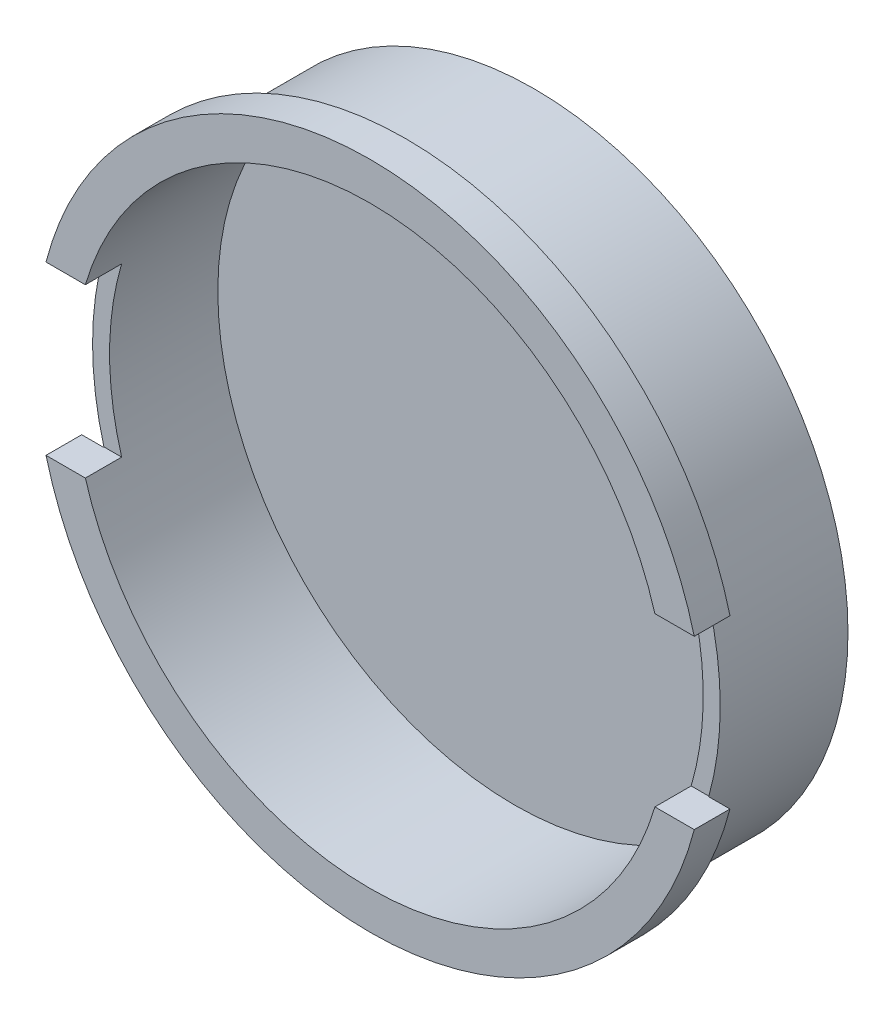
from build123d import *

# Parameters (mm, degrees)
SKETCH1_R           = 14.2875
BOSS_EXTRUDE1_DEPTH = 0.889
SKETCH2_R           = 14.2875
SKETCH2_R_2         = 13.5128
BOSS_EXTRUDE2_DEPTH = 4.953
SKETCH3_R           = 15.24
SKETCH3_R_2         = 13.5128
BOSS_EXTRUDE3_DEPTH = 1.6256
SKETCH4_W           = 38.1
SKETCH4_H           = 7.62
CUT_EXTRUDE1_DEPTH  = 1.651
SKETCH5_R           = 0.381
CUT_EXTRUDE2_DEPTH  = 23.480911787
SKETCH7_R           = 0.381
BOSS_EXTRUDE5_DEPTH = 0.9144


with BuildPart() as part:
    # Sketch1 → Boss-Extrude1 (new body)
    with BuildSketch(Plane.XY):
        Circle(SKETCH1_R)
    extrude(amount=BOSS_EXTRUDE1_DEPTH)

    # Sketch2 → Boss-Extrude2 (add)
    with BuildSketch(Plane.XY.offset(0.889)):
        Circle(SKETCH2_R)
        Circle(SKETCH2_R_2, mode=Mode.SUBTRACT)
    extrude(amount=BOSS_EXTRUDE2_DEPTH)

    # Sketch3 → Boss-Extrude3 (add)
    with BuildSketch(Plane.XY.offset(5.842)):
        Circle(SKETCH3_R)
        Circle(SKETCH3_R_2, mode=Mode.SUBTRACT)
    extrude(amount=BOSS_EXTRUDE3_DEPTH)

    # Sketch4 → Cut-Extrude1 (cut)
    with BuildSketch(Plane.XY.offset(7.4676)):
        Rectangle(SKETCH4_W, SKETCH4_H)
    extrude(amount=-CUT_EXTRUDE1_DEPTH, mode=Mode.SUBTRACT)

    # Sketch5 → Cut-Extrude2 (cut, through all)
    with BuildSketch(Plane.XY.offset(7.4426)):
        with Locations((0, 12.7)):
            Circle(SKETCH5_R)
        with Locations((4.860079591, 11.733270063)):
            Circle(SKETCH5_R)
        with Locations((8.980256121, 8.980256121)):
            Circle(SKETCH5_R)
        with Locations((11.733270063, 4.860079591)):
            Circle(SKETCH5_R)
        with Locations((12.7, 0)):
            Circle(SKETCH5_R)
        with Locations((11.733270063, -4.860079591)):
            Circle(SKETCH5_R)
        with Locations((8.980256121, -8.980256121)):
            Circle(SKETCH5_R)
        with Locations((4.860079591, -11.733270063)):
            Circle(SKETCH5_R)
        with Locations((0, -12.7)):
            Circle(SKETCH5_R)
        with Locations((-4.860079591, -11.733270063)):
            Circle(SKETCH5_R)
        with Locations((-8.980256121, -8.980256121)):
            Circle(SKETCH5_R)
        with Locations((-11.733270063, -4.860079591)):
            Circle(SKETCH5_R)
        with Locations((-12.7, 0)):
            Circle(SKETCH5_R)
        with Locations((-11.733270063, 4.860079591)):
            Circle(SKETCH5_R)
        with Locations((-8.980256121, 8.980256121)):
            Circle(SKETCH5_R)
        with Locations((-4.860079591, 11.733270063)):
            Circle(SKETCH5_R)
        with BuildLine():
            Line((-2.176113006, 0.452326575), (-2.749499288, 3.704161775))
            ThreePointArc((-2.749499288, 3.704161775), (-3.132021437, 3.972006667), (-3.399866328, 3.589484519))
            Line((-3.399866328, 3.589484519), (-2.826480046, 0.337649318))
            ThreePointArc((-2.826480046, 0.337649318), (-2.443957897, 0.069804426), (-2.176113006, 0.452326575))
        make_face()
        with BuildLine():
            Line((-6.400133672, -3.843484519), (-6.973519954, -0.591649318))
            ThreePointArc((-6.973519954, -0.591649318), (-7.356042103, -0.323804426), (-7.623886994, -0.706326575))
            Line((-7.623886994, -0.706326575), (-7.050500712, -3.958161775))
            ThreePointArc((-7.050500712, -3.958161775), (-6.667978563, -4.226006667), (-6.400133672, -3.843484519))
        make_face()
        with BuildLine():
            Line((-1.400274291, -3.947673425), (-1.973660573, -0.695838225))
            ThreePointArc((-1.973660573, -0.695838225), (-2.356182722, -0.427993333), (-2.624027613, -0.810515481))
            Line((-2.624027613, -0.810515481), (-2.050641331, -4.062350682))
            ThreePointArc((-2.050641331, -4.062350682), (-1.668119182, -4.330195574), (-1.400274291, -3.947673425))
        make_face()
        with BuildLine():
            Line((-7.175972387, 0.556515481), (-7.749358669, 3.808350682))
            ThreePointArc((-7.749358669, 3.808350682), (-8.131880818, 4.076195574), (-8.399725709, 3.693673425))
            Line((-8.399725709, 3.693673425), (-7.826339427, 0.441838225))
            ThreePointArc((-7.826339427, 0.441838225), (-7.443817278, 0.173993333), (-7.175972387, 0.556515481))
        make_face()
        with BuildLine():
            Line((-3.376, 0.2032), (-6.424, 0.2032))
            ThreePointArc((-6.424, 0.2032), (-6.7542, -0.127), (-6.424, -0.4572))
            Line((-6.424, -0.4572), (-3.376, -0.4572))
            ThreePointArc((-3.376, -0.4572), (-3.0458, -0.127), (-3.376, 0.2032))
        make_face()
        with BuildLine():
            Line((-2.600161285, -4.1968), (-5.648161285, -4.1968))
            ThreePointArc((-5.648161285, -4.1968), (-5.978361285, -4.527), (-5.648161285, -4.8572))
            Line((-5.648161285, -4.8572), (-2.600161285, -4.8572))
            ThreePointArc((-2.600161285, -4.8572), (-2.269961285, -4.527), (-2.600161285, -4.1968))
        make_face()
        with BuildLine():
            Line((-4.151838715, 4.6032), (-7.199838715, 4.6032))
            ThreePointArc((-7.199838715, 4.6032), (-7.530038715, 4.273), (-7.199838715, 3.9428))
            Line((-7.199838715, 3.9428), (-4.151838715, 3.9428))
            ThreePointArc((-4.151838715, 3.9428), (-3.821638715, 4.273), (-4.151838715, 4.6032))
        make_face()
        with BuildLine():
            Line((7.623886994, 0.452326575), (7.050500712, 3.704161775))
            ThreePointArc((7.050500712, 3.704161775), (6.667978563, 3.972006667), (6.400133672, 3.589484519))
            Line((6.400133672, 3.589484519), (6.973519954, 0.337649318))
            ThreePointArc((6.973519954, 0.337649318), (7.356042103, 0.069804426), (7.623886994, 0.452326575))
        make_face()
        with BuildLine():
            Line((3.399866328, -3.843484519), (2.826480046, -0.591649318))
            ThreePointArc((2.826480046, -0.591649318), (2.443957897, -0.323804426), (2.176113006, -0.706326575))
            Line((2.176113006, -0.706326575), (2.749499288, -3.958161775))
            ThreePointArc((2.749499288, -3.958161775), (3.132021437, -4.226006667), (3.399866328, -3.843484519))
        make_face()
        with BuildLine():
            Line((8.399725709, -3.947673425), (7.826339427, -0.695838225))
            ThreePointArc((7.826339427, -0.695838225), (7.443817278, -0.427993333), (7.175972387, -0.810515481))
            Line((7.175972387, -0.810515481), (7.749358669, -4.062350682))
            ThreePointArc((7.749358669, -4.062350682), (8.131880818, -4.330195574), (8.399725709, -3.947673425))
        make_face()
        with BuildLine():
            Line((2.624027613, 0.556515481), (2.050641331, 3.808350682))
            ThreePointArc((2.050641331, 3.808350682), (1.668119182, 4.076195574), (1.400274291, 3.693673425))
            Line((1.400274291, 3.693673425), (1.973660573, 0.441838225))
            ThreePointArc((1.973660573, 0.441838225), (2.356182722, 0.173993333), (2.624027613, 0.556515481))
        make_face()
        with BuildLine():
            Line((6.424, 0.2032), (3.376, 0.2032))
            ThreePointArc((3.376, 0.2032), (3.0458, -0.127), (3.376, -0.4572))
            Line((3.376, -0.4572), (6.424, -0.4572))
            ThreePointArc((6.424, -0.4572), (6.7542, -0.127), (6.424, 0.2032))
        make_face()
        with BuildLine():
            Line((7.199838715, -4.1968), (4.151838715, -4.1968))
            ThreePointArc((4.151838715, -4.1968), (3.821638715, -4.527), (4.151838715, -4.8572))
            Line((4.151838715, -4.8572), (7.199838715, -4.8572))
            ThreePointArc((7.199838715, -4.8572), (7.530038715, -4.527), (7.199838715, -4.1968))
        make_face()
        with BuildLine():
            Line((5.648161285, 4.6032), (2.600161285, 4.6032))
            ThreePointArc((2.600161285, 4.6032), (2.269961285, 4.273), (2.600161285, 3.9428))
            Line((2.600161285, 3.9428), (5.648161285, 3.9428))
            ThreePointArc((5.648161285, 3.9428), (5.978361285, 4.273), (5.648161285, 4.6032))
        make_face()
    extrude(amount=-CUT_EXTRUDE2_DEPTH, mode=Mode.SUBTRACT)

    # Sketch7 → Boss-Extrude5 (add)
    with BuildSketch(Plane(origin=(0, 0, 0.889), x_dir=(-1, 0, 0), z_dir=(0, 0, -1))):
        with Locations(Location((-11.733270063, 4.860079591, 0), (0, 0, 180))):
            Circle(SKETCH7_R)
        with Locations(Location((-8.980256121, 8.980256121, 0), (0, 0, 180))):
            Circle(SKETCH7_R)
        with Locations(Location((-4.860079591, 11.733270063, 0), (0, 0, 180))):
            Circle(SKETCH7_R)
        with Locations(Location((0, 12.7, 0), (0, 0, 180))):
            Circle(SKETCH7_R)
        with Locations(Location((4.860079591, -11.733270063, 0), (0, 0, 180))):
            Circle(SKETCH7_R)
        with Locations(Location((0, -12.7, 0), (0, 0, 180))):
            Circle(SKETCH7_R)
        with Locations(Location((-4.860079591, -11.733270063, 0), (0, 0, 180))):
            Circle(SKETCH7_R)
        with Locations(Location((-8.980256121, -8.980256121, 0), (0, 0, 180))):
            Circle(SKETCH7_R)
        with Locations(Location((-11.733270063, -4.860079591, 0), (0, 0, 180))):
            Circle(SKETCH7_R)
        with Locations(Location((-12.7, 0, 0), (0, 0, 180))):
            Circle(SKETCH7_R)
        with Locations(Location((4.860079591, 11.733270063, 0), (0, 0, 180))):
            Circle(SKETCH7_R)
        with Locations(Location((8.980256121, 8.980256121, 0), (0, 0, 180))):
            Circle(SKETCH7_R)
        with Locations(Location((11.733270063, 4.860079591, 0), (0, 0, 180))):
            Circle(SKETCH7_R)
        with Locations(Location((12.7, 0, 0), (0, 0, 180))):
            Circle(SKETCH7_R)
        with Locations(Location((11.733270063, -4.860079591, 0), (0, 0, 180))):
            Circle(SKETCH7_R)
        with Locations(Location((8.980256121, -8.980256121, 0), (0, 0, 180))):
            Circle(SKETCH7_R)
        with BuildLine():
            Line((2.749499288, 3.704161775), (2.176113006, 0.452326575))
            ThreePointArc((2.176113006, 0.452326575), (2.443957897, 0.069804426), (2.826480046, 0.337649318))
            Line((2.826480046, 0.337649318), (3.399866328, 3.589484519))
            ThreePointArc((3.399866328, 3.589484519), (3.132021437, 3.972006667), (2.749499288, 3.704161775))
        make_face()
        with BuildLine():
            Line((1.973660573, -0.695838225), (1.400274291, -3.947673425))
            ThreePointArc((1.400274291, -3.947673425), (1.668119182, -4.330195574), (2.050641331, -4.062350682))
            Line((2.050641331, -4.062350682), (2.624027613, -0.810515481))
            ThreePointArc((2.624027613, -0.810515481), (2.356182722, -0.427993333), (1.973660573, -0.695838225))
        make_face()
        with BuildLine():
            Line((7.050500712, -3.958161775), (7.623886994, -0.706326575))
            ThreePointArc((7.623886994, -0.706326575), (7.356042103, -0.323804426), (6.973519954, -0.591649318))
            Line((6.973519954, -0.591649318), (6.400133672, -3.843484519))
            ThreePointArc((6.400133672, -3.843484519), (6.667978563, -4.226006667), (7.050500712, -3.958161775))
        make_face()
        with BuildLine():
            Line((5.648161285, -4.1968), (2.600161285, -4.1968))
            ThreePointArc((2.600161285, -4.1968), (2.269961285, -4.527), (2.600161285, -4.8572))
            Line((2.600161285, -4.8572), (5.648161285, -4.8572))
            ThreePointArc((5.648161285, -4.8572), (5.978361285, -4.527), (5.648161285, -4.1968))
        make_face()
        with BuildLine():
            Line((6.424, 0.2032), (3.376, 0.2032))
            ThreePointArc((3.376, 0.2032), (3.0458, -0.127), (3.376, -0.4572))
            Line((3.376, -0.4572), (6.424, -0.4572))
            ThreePointArc((6.424, -0.4572), (6.7542, -0.127), (6.424, 0.2032))
        make_face()
        with BuildLine():
            Line((7.749358669, 3.808350682), (7.175972387, 0.556515481))
            ThreePointArc((7.175972387, 0.556515481), (7.443817278, 0.173993333), (7.826339427, 0.441838225))
            Line((7.826339427, 0.441838225), (8.399725709, 3.693673425))
            ThreePointArc((8.399725709, 3.693673425), (8.131880818, 4.076195574), (7.749358669, 3.808350682))
        make_face()
        with BuildLine():
            Line((-2.826480046, -0.591649318), (-3.399866328, -3.843484519))
            ThreePointArc((-3.399866328, -3.843484519), (-3.132021437, -4.226006667), (-2.749499288, -3.958161775))
            Line((-2.749499288, -3.958161775), (-2.176113006, -0.706326575))
            ThreePointArc((-2.176113006, -0.706326575), (-2.443957897, -0.323804426), (-2.826480046, -0.591649318))
        make_face()
        with BuildLine():
            Line((-7.050500712, 3.704161775), (-7.623886994, 0.452326575))
            ThreePointArc((-7.623886994, 0.452326575), (-7.356042103, 0.069804426), (-6.973519954, 0.337649318))
            Line((-6.973519954, 0.337649318), (-6.400133672, 3.589484519))
            ThreePointArc((-6.400133672, 3.589484519), (-6.667978563, 3.972006667), (-7.050500712, 3.704161775))
        make_face()
        with BuildLine():
            Line((4.151838715, 3.9428), (7.199838715, 3.9428))
            ThreePointArc((7.199838715, 3.9428), (7.530038715, 4.273), (7.199838715, 4.6032))
            Line((7.199838715, 4.6032), (4.151838715, 4.6032))
            ThreePointArc((4.151838715, 4.6032), (3.821638715, 4.273), (4.151838715, 3.9428))
        make_face()
        with BuildLine():
            Line((-2.050641331, 3.808350682), (-2.624027613, 0.556515481))
            ThreePointArc((-2.624027613, 0.556515481), (-2.356182722, 0.173993333), (-1.973660573, 0.441838225))
            Line((-1.973660573, 0.441838225), (-1.400274291, 3.693673425))
            ThreePointArc((-1.400274291, 3.693673425), (-1.668119182, 4.076195574), (-2.050641331, 3.808350682))
        make_face()
        with BuildLine():
            Line((-7.749358669, -4.062350682), (-7.175972387, -0.810515481))
            ThreePointArc((-7.175972387, -0.810515481), (-7.443817278, -0.427993333), (-7.826339427, -0.695838225))
            Line((-7.826339427, -0.695838225), (-8.399725709, -3.947673425))
            ThreePointArc((-8.399725709, -3.947673425), (-8.131880818, -4.330195574), (-7.749358669, -4.062350682))
        make_face()
        with BuildLine():
            Line((-2.600161285, 4.6032), (-5.648161285, 4.6032))
            ThreePointArc((-5.648161285, 4.6032), (-5.978361285, 4.273), (-5.648161285, 3.9428))
            Line((-5.648161285, 3.9428), (-2.600161285, 3.9428))
            ThreePointArc((-2.600161285, 3.9428), (-2.269961285, 4.273), (-2.600161285, 4.6032))
        make_face()
        with BuildLine():
            Line((-4.151838715, -4.1968), (-7.199838715, -4.1968))
            ThreePointArc((-7.199838715, -4.1968), (-7.530038715, -4.527), (-7.199838715, -4.8572))
            Line((-7.199838715, -4.8572), (-4.151838715, -4.8572))
            ThreePointArc((-4.151838715, -4.8572), (-3.821638715, -4.527), (-4.151838715, -4.1968))
        make_face()
        with BuildLine():
            Line((-3.376, 0.2032), (-6.424, 0.2032))
            ThreePointArc((-6.424, 0.2032), (-6.7542, -0.127), (-6.424, -0.4572))
            Line((-6.424, -0.4572), (-3.376, -0.4572))
            ThreePointArc((-3.376, -0.4572), (-3.0458, -0.127), (-3.376, 0.2032))
        make_face()
    extrude(amount=BOSS_EXTRUDE5_DEPTH)


solid = part.part
